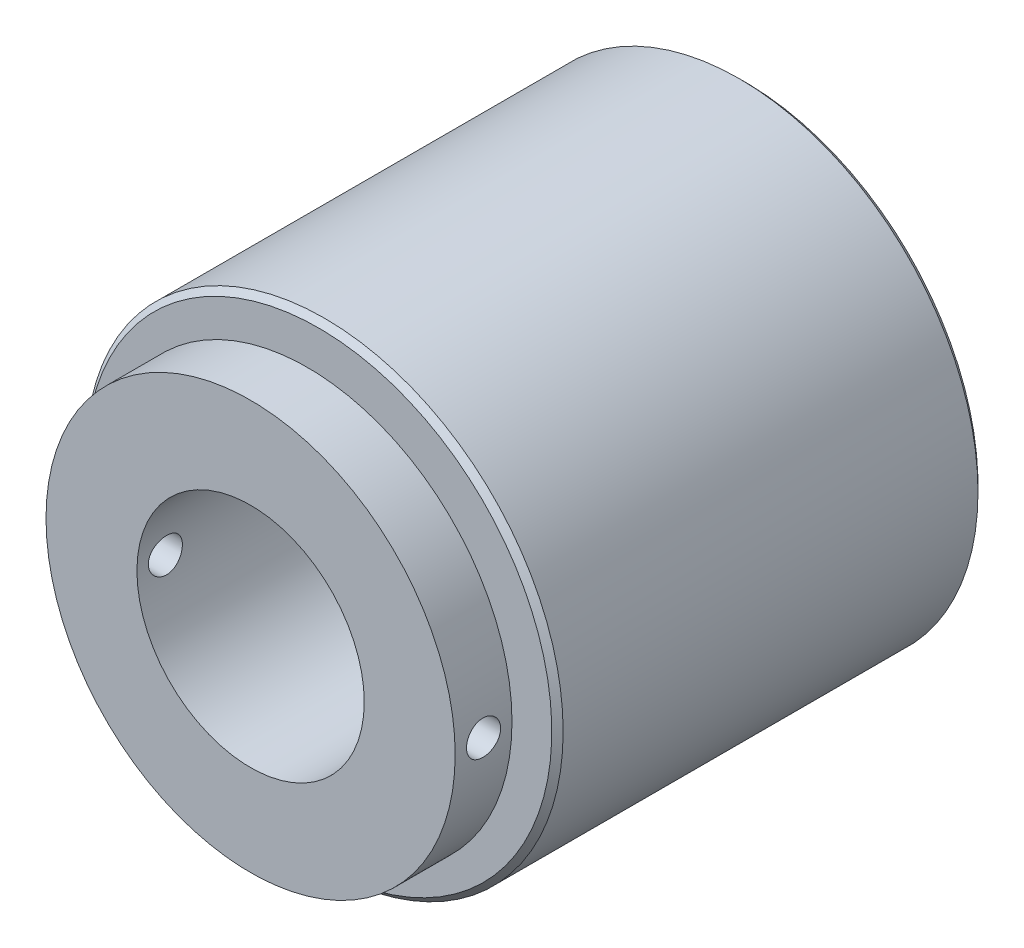
from build123d import *
from build123d.topology import SkipClean

# Parameters (mm, degrees)
SKETCH_1_R               = 18
SKETCH_1_R_2             = 10
EXTRUDE_1_DEPTH          = 5
CUT_EXTRUDE_1_DEPTH      = 35
CUT_EXTRUDE_1_DEPTH_BACK = 19
SKETCH_2_R               = 1.5
EXTRUDE_START            = 1
SKETCH_3_R               = 10.41594451
SKETCH_3_R_2             = 10
EXTRUDE_2_DEPTH          = 1
EXTRUDE_START_2          = 37.5
SKETCH_4_R               = 21
SKETCH_4_R_2             = 10
EXTRUDE_3_DEPTH          = 37.5
CHAMFER_1_SIZE           = 0.5
SKETCH_5_R               = 1
CUT_EXTRUDE_2_DEPTH      = 1


with BuildPart() as part:
    # 草图1 → 凸台-拉伸1 (new body)
    with BuildSketch(Plane.XY):
        Circle(SKETCH_1_R)
        Circle(SKETCH_1_R_2, mode=Mode.SUBTRACT)
    extrude(amount=EXTRUDE_1_DEPTH)

    # 草图2 → 切除-拉伸1 (cut, two sides: drawn at the far end of the back side and taken through both)
    with BuildSketch(Plane(origin=(0, 0, 0), x_dir=(0, 0, -1), z_dir=(1, 0, 0)).offset(-CUT_EXTRUDE_1_DEPTH_BACK)):
        with Locations(Location((-2.5, 0, 0), (0, 0, 180))):
            Circle(SKETCH_2_R)
    extrude(amount=CUT_EXTRUDE_1_DEPTH + CUT_EXTRUDE_1_DEPTH_BACK, mode=Mode.SUBTRACT)

    # 草图3 → 凸台-拉伸2 (add)
    with SkipClean():  # the faces are left unmerged after this step: merging them gives an invalid solid
        with BuildSketch(Plane(origin=(0, 0, 0), x_dir=(-1, 0, 0), z_dir=(0, 0, -1)).offset(EXTRUDE_START)):
            Circle(SKETCH_3_R)
            Circle(SKETCH_3_R_2, mode=Mode.SUBTRACT)
        extrude(amount=-EXTRUDE_2_DEPTH)

    # 草图4 → 凸台-拉伸3 (add)
    with SkipClean():  # the faces are left unmerged after this step: merging them gives an invalid solid
        with BuildSketch(Plane(origin=(0, 0, -1), x_dir=(-1, 0, 0), z_dir=(0, 0, -1)).offset(EXTRUDE_START_2)):
            Circle(SKETCH_4_R)
            Circle(SKETCH_4_R_2, mode=Mode.SUBTRACT)
        extrude(amount=-EXTRUDE_3_DEPTH)

    # 倒角1
    chamfer_1_edges = [part.edges().sort_by_distance(p)[0] for p in [
        (21, 0, -38.5),
        (21, 0, -1),
    ]]
    chamfer(chamfer_1_edges, length=CHAMFER_1_SIZE)

    # 草图5 → 切除-拉伸2 (cut)
    with BuildSketch(Plane(origin=(0, 0, -38.5), x_dir=(-1, 0, 0), z_dir=(0, 0, -1))):
        with Locations((3, -18)):
            Circle(SKETCH_5_R)
        with Locations((-3, -18)):
            Circle(SKETCH_5_R)
        with Locations((-3, 18)):
            Circle(SKETCH_5_R)
        with Locations((3, 18)):
            Circle(SKETCH_5_R)
    extrude(amount=-CUT_EXTRUDE_2_DEPTH, mode=Mode.SUBTRACT)


solid = part.part
